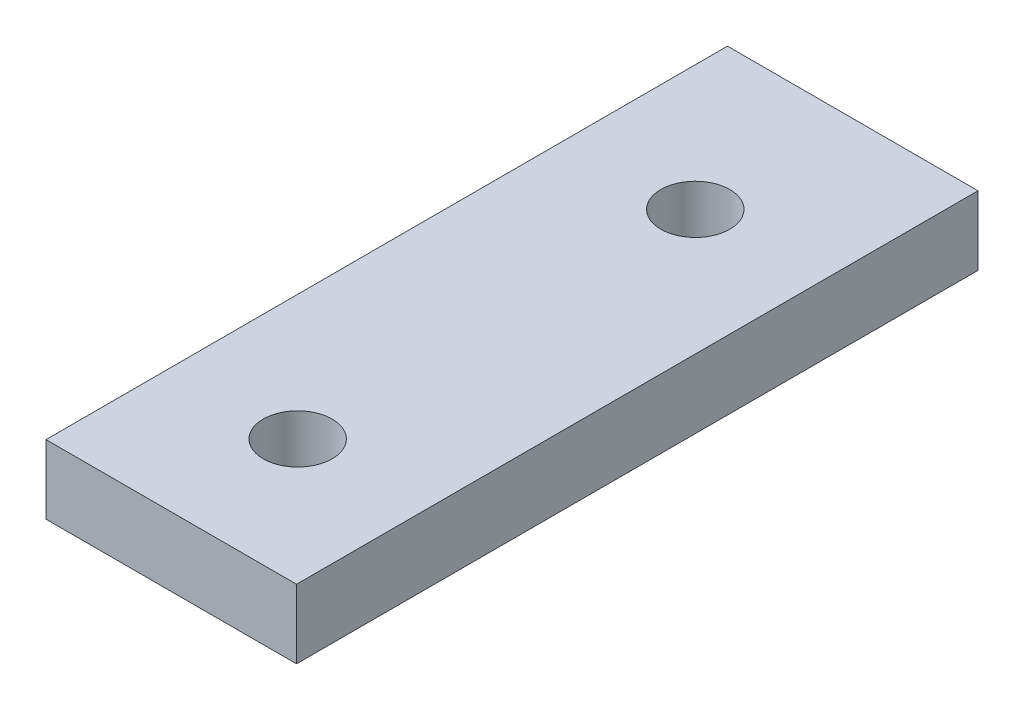
from build123d import *

# Parameters (mm, degrees)
SKETCH1_R           = 1.5
BOSS_EXTRUDE1_DEPTH = 3


with BuildPart() as part:
    # Sketch1 → Boss-Extrude1 (new body)
    with BuildSketch(Plane(origin=(0, 0, 0), x_dir=(1, 0, 0), z_dir=(0, 1, 0))):
        Polygon((160.439139144, 80.165), (160.439139144, 57.865), (160.439139144, 54.865), (171.339139144, 54.865), (171.339139144, 57.865), (171.339139144, 80.165), (171.339139144, 84.515), (160.439139144, 84.515), align=None)
        with Locations(Location((165.889139144, 77.665, 0), (0, 0, 270))):
            Circle(SKETCH1_R, mode=Mode.SUBTRACT)
        with Locations(Location((165.889139144, 60.365, 0), (0, 0, 270))):
            Circle(SKETCH1_R, mode=Mode.SUBTRACT)
    extrude(amount=BOSS_EXTRUDE1_DEPTH)


solid = part.part
